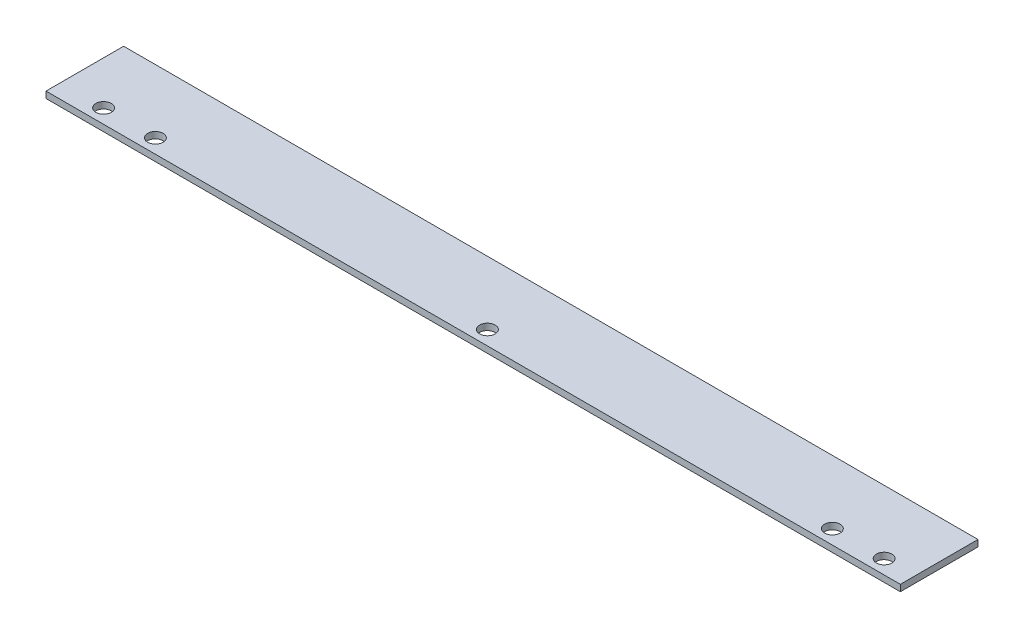
from build123d import *

# Parameters (mm, degrees)
SKETCH2_W             = 209.55
SKETCH2_H             = 19.05
BOSS_EXTRUDE1_DEPTH   = 1.5875
F_6_CLEARANCE_HOLE1_D = 3.7973


with BuildPart() as part:
    # Sketch2 → Boss-Extrude1 (new body)
    with BuildSketch(Plane(origin=(0, 0, 0), x_dir=(1, 0, 0), z_dir=(0, 1, 0))):
        Rectangle(SKETCH2_W, SKETCH2_H)
    extrude(amount=BOSS_EXTRUDE1_DEPTH)

    # #6 Clearance Hole1 (through all)
    with Locations(Plane(origin=(0, 1.5875, 0), x_dir=(1, 0, 0), z_dir=(0, 1, 0))):
        with Locations((-94.13723666, -6.034928337), (0, -6.034928337), (97.31223666, -6.034928337), (-81.43723666, -6.034928337), (84.61223666, -6.034928337)):
            Hole(F_6_CLEARANCE_HOLE1_D / 2)


solid = part.part
